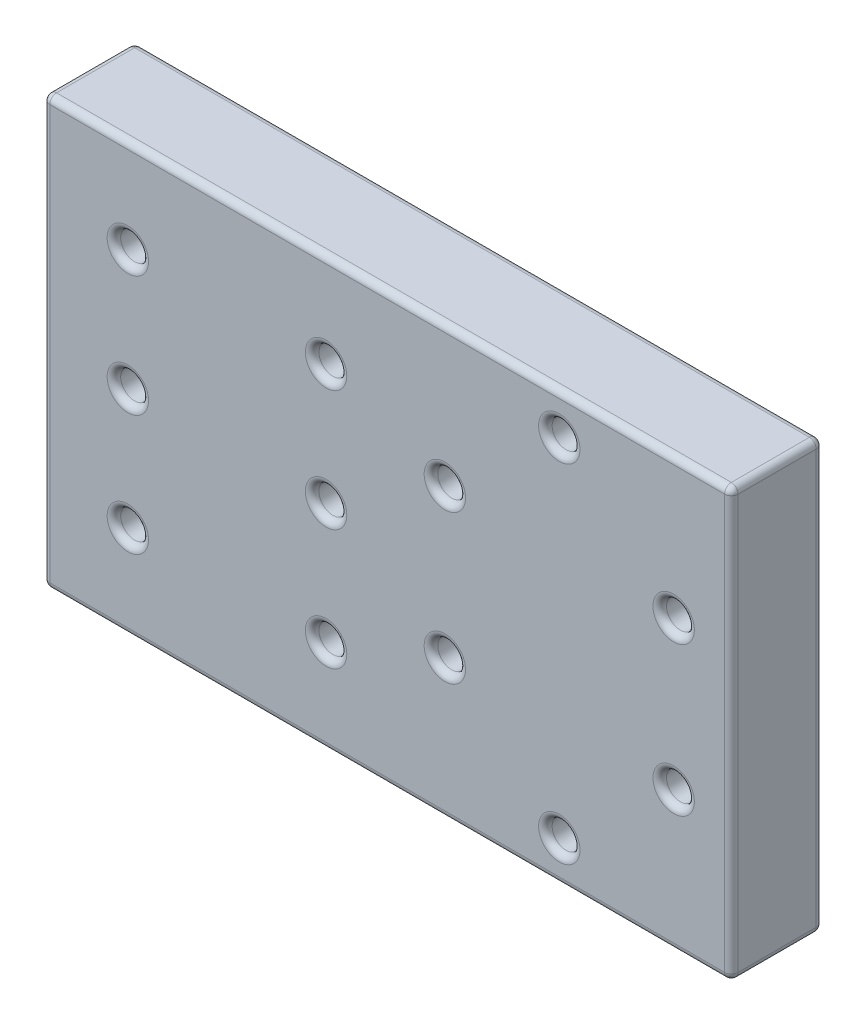
from build123d import *

# Parameters (mm, degrees)
SKETCH_1_W          = 101.4
SKETCH_1_H          = 63
EXTRUDE_1_DEPTH     = 13.5
SKETCH_2_R          = 2.05
CUT_EXTRUDE_1_DEPTH = 62.196323419
FILLET_1_R          = 1


with BuildPart() as part:
    # 스케치1 → 보스-돌출1 (new body)
    with BuildSketch(Plane.XY):
        Rectangle(SKETCH_1_W, SKETCH_1_H)
    extrude(amount=EXTRUDE_1_DEPTH)

    # 스케치2 → 컷-돌출1 (cut, through all)
    with BuildSketch(Plane.XY.offset(13.5)):
        with Locations((-38.2, 17.75)):
            Circle(SKETCH_2_R)
        with Locations((-38.2, 0)):
            Circle(SKETCH_2_R)
        with Locations((-38.2, -17.75)):
            Circle(SKETCH_2_R)
        with Locations((-9, 17.75)):
            Circle(SKETCH_2_R)
        with Locations((-9, 0)):
            Circle(SKETCH_2_R)
        with Locations((-9, -17.75)):
            Circle(SKETCH_2_R)
        with Locations((25.35, 25.55)):
            Circle(SKETCH_2_R)
        with Locations((8.5, 10.95)):
            Circle(SKETCH_2_R)
        with Locations((8.5, -10.95)):
            Circle(SKETCH_2_R)
        with Locations((42.2, 10.95)):
            Circle(SKETCH_2_R)
        with Locations((42.2, -10.95)):
            Circle(SKETCH_2_R)
        with Locations((25.35, -25.55)):
            Circle(SKETCH_2_R)
    extrude(amount=-CUT_EXTRUDE_1_DEPTH, mode=Mode.SUBTRACT)

    # 필렛1
    fillet_1_edges = [part.edges().sort_by_distance(p)[0] for p in [
        (50.7, 0, 13.5),
        (0, 31.5, 13.5),
        (-40.25, 17.75, 0),
        (-40.25, 17.75, 13.5),
        (-40.25, 0, 0),
        (-40.25, 0, 13.5),
        (-40.25, -17.75, 0),
        (-40.25, -17.75, 13.5),
        (-11.05, 17.75, 0),
        (-11.05, 17.75, 13.5),
        (-11.05, 0, 0),
        (-11.05, 0, 13.5),
        (-11.05, -17.75, 0),
        (-11.05, -17.75, 13.5),
        (23.3, -25.55, 0),
        (23.3, -25.55, 13.5),
        (-50.7, 0, 13.5),
        (40.15, -10.95, 0),
        (40.15, -10.95, 13.5),
        (40.15, 10.95, 0),
        (40.15, 10.95, 13.5),
        (6.45, -10.95, 0),
        (0, 31.5, 0),
        (6.45, -10.95, 13.5),
        (6.45, 10.95, 0),
        (6.45, 10.95, 13.5),
        (23.3, 25.55, 0),
        (23.3, 25.55, 13.5),
        (50.7, 0, 0),
        (0, -31.5, 0),
        (-50.7, 0, 0),
        (0, -31.5, 13.5),
        (-50.7, 31.5, 6.75),
        (50.7, 31.5, 6.75),
        (50.7, -31.5, 6.75),
        (-50.7, -31.5, 6.75),
    ]]
    fillet(fillet_1_edges, radius=FILLET_1_R)


solid = part.part
